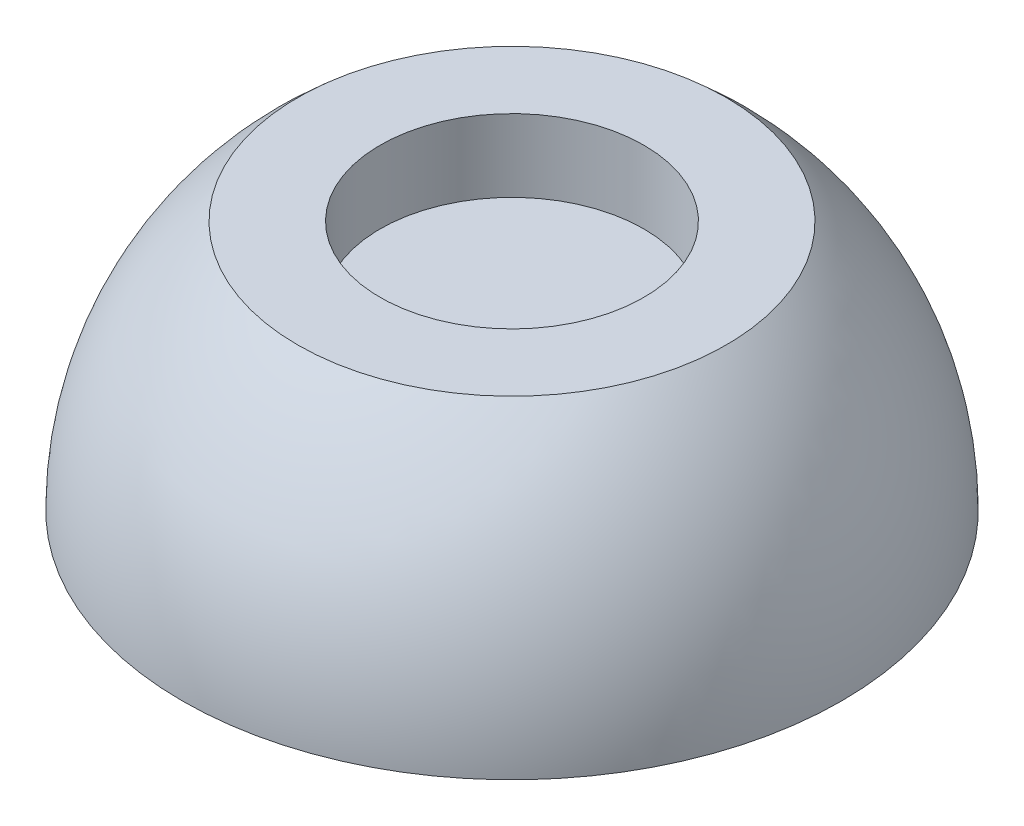
from build123d import *

# Parameters (mm, degrees)
CUT_EXTRUDE1_DEPTH = 5


with BuildPart() as part:
    # Sketch1 → Revolve1 (revolve)
    with BuildSketch(Plane.XY, mode=Mode.PRIVATE) as revolve1_sk:
        with BuildLine():
            Line((12.5, 0), (0, 0))
            Line((0, 0), (0, 6.75))
            Line((0, 6.75), (5, 6.75))
            Line((5, 6.75), (5, 9.5))
            Line((5, 9.5), (8.124038405, 9.5))
            ThreePointArc((8.124038405, 9.5), (11.353424154, 5.229699797), (12.5, 0))
        make_face()
    revolve(revolve1_sk.sketch.rotate(Axis((0, 0, 0), (0, 1, 0)), 90), axis=Axis((0, 0, 0), (0, 1, 0)))

    # Sketch2 → Cut-Extrude1 (cut)
    with BuildSketch(Plane(origin=(0, 0, 0), x_dir=(1, 0, 0), z_dir=(0, 1, 0))):
        Polygon((0, 9), (2.556172718, 3.518269915), (8.559508647, 2.781152949), (4.13597434, -1.343859526), (5.290067271, -7.281152949), (0, -4.348820778), (-5.290067271, -7.281152949), (-4.13597434, -1.343859526), (-8.559508647, 2.781152949), (-2.556172718, 3.518269915), align=None)
    extrude(amount=CUT_EXTRUDE1_DEPTH, mode=Mode.SUBTRACT)


solid = part.part
